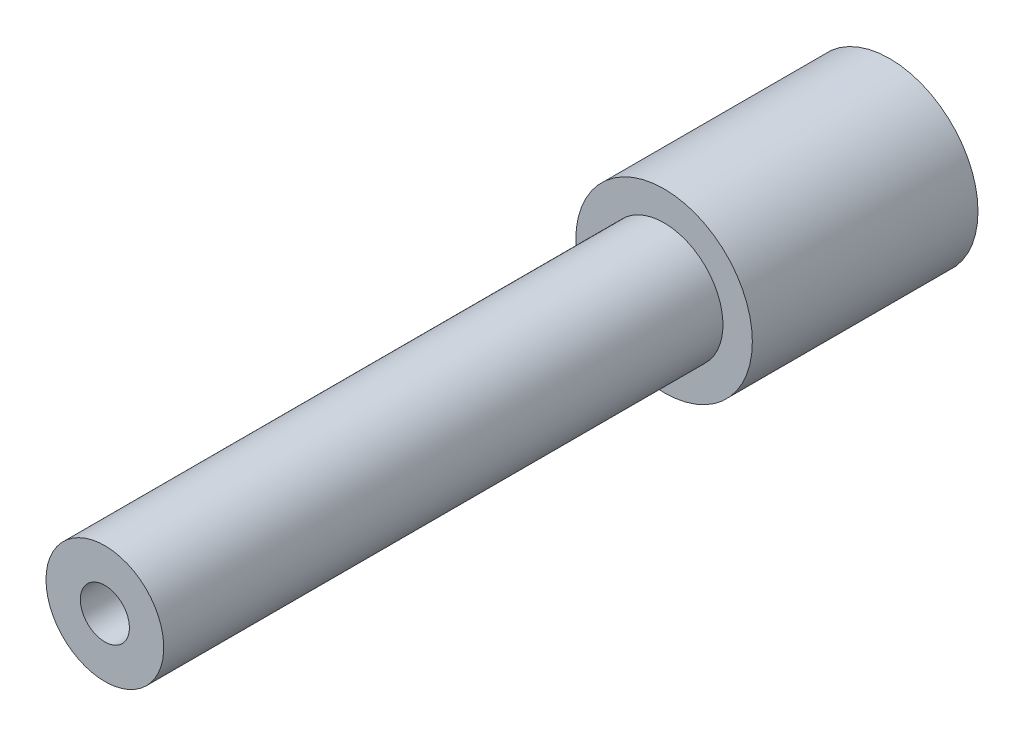
from build123d import *

# Parameters (mm, degrees)
SKETCH1_R           = 4.5
BOSS_EXTRUDE2_DEPTH = 11.5
SKETCH16_R          = 3
BOSS_EXTRUDE3_DEPTH = 28.5
SKETCH17_R          = 1.25
CUT_EXTRUDE1_DEPTH  = 7


with BuildPart() as part:
    # Sketch1 → Boss-Extrude2 (new body)
    with BuildSketch(Plane.XY):
        Circle(SKETCH1_R)
    extrude(amount=BOSS_EXTRUDE2_DEPTH)

    # Sketch16 → Boss-Extrude3 (add)
    with BuildSketch(Plane.XY.offset(11.5)):
        with Locations(Location((0, 0, 0), (0, 0, 180))):
            Circle(SKETCH16_R)
    extrude(amount=BOSS_EXTRUDE3_DEPTH)

    # Sketch17 → Cut-Extrude1 (cut)
    with BuildSketch(Plane.XY.offset(40)):
        Circle(SKETCH17_R)
    extrude(amount=-CUT_EXTRUDE1_DEPTH, mode=Mode.SUBTRACT)


solid = part.part
